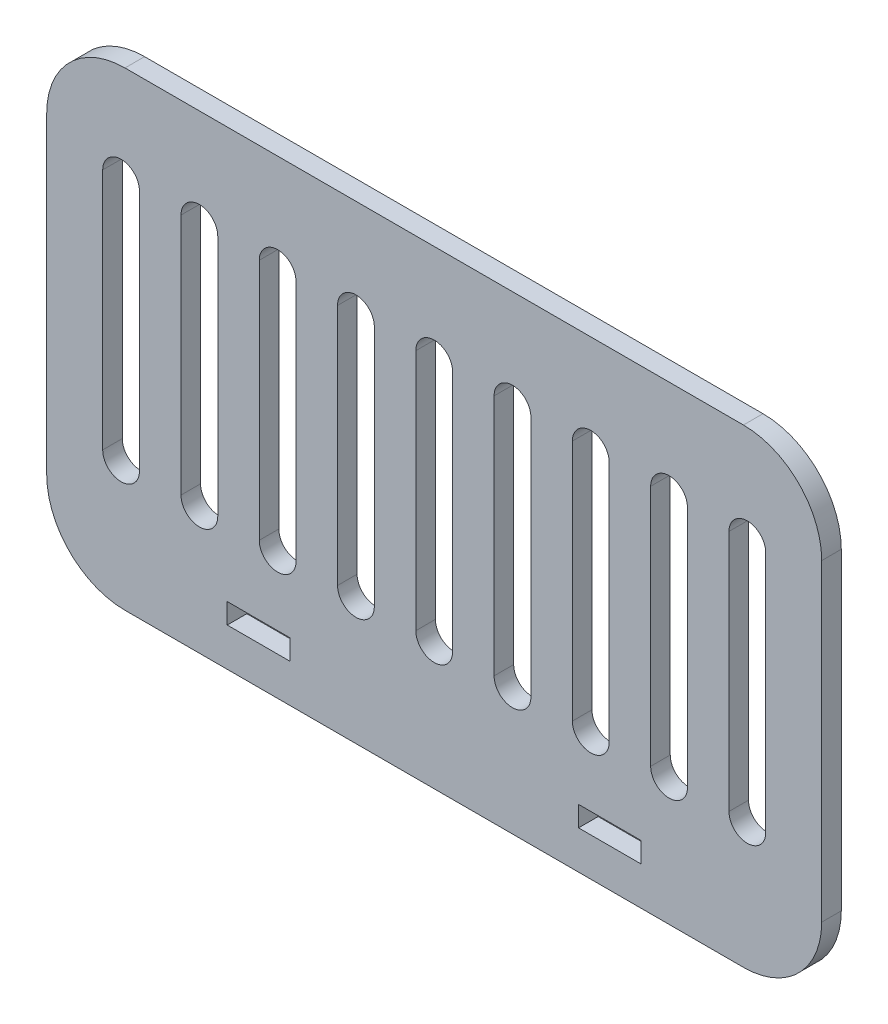
from build123d import *

# Parameters (mm, degrees)
SKETCH1_W           = 125.73
SKETCH1_H           = 76.2
SKETCH1_W_2         = 10.16
SKETCH1_H_2         = 3.302
BOSS_EXTRUDE1_DEPTH = 3.175
FILLET1_R           = 12.7
CUT_EXTRUDE2_DEPTH  = 74.577842113


with BuildPart() as part:
    # Sketch1 → Boss-Extrude1 (new body)
    with BuildSketch(Plane.XY):
        Rectangle(SKETCH1_W, SKETCH1_H)
        with Locations((-28.4988, -30.226)):
            Rectangle(SKETCH1_W_2, SKETCH1_H_2, mode=Mode.SUBTRACT)
        with Locations((28.4988, -30.226)):
            Rectangle(SKETCH1_W_2, SKETCH1_H_2, mode=Mode.SUBTRACT)
    extrude(amount=BOSS_EXTRUDE1_DEPTH)

    # Fillet1
    fillet1_edges = [part.edges().sort_by_distance(p)[0] for p in [
        (62.865, -38.1, 1.5875),
        (-62.865, -38.1, 1.5875),
        (-62.865, 38.1, 1.5875),
        (62.865, 38.1, 1.5875),
    ]]
    fillet(fillet1_edges, radius=FILLET1_R)

    # Sketch5 → Cut-Extrude2 (cut, through all)
    with BuildSketch(Plane.XY.offset(3.175)):
        with BuildLine():
            Line((2.984111333, 21.969779064), (2.984111333, -17.372056987))
            ThreePointArc((2.984111333, -17.372056987), (0, -20.35616832), (-2.984111333, -17.372056987))
            Line((-2.984111333, -17.372056987), (-2.984111333, 21.969779064))
            ThreePointArc((-2.984111333, 21.969779064), (0, 24.953890397), (2.984111333, 21.969779064))
        make_face()
        with BuildLine():
            Line((15.684111333, 21.969779064), (15.684111333, -17.372056987))
            ThreePointArc((15.684111333, -17.372056987), (12.7, -20.35616832), (9.715888667, -17.372056987))
            Line((9.715888667, -17.372056987), (9.715888667, 21.969779064))
            ThreePointArc((9.715888667, 21.969779064), (12.7, 24.953890397), (15.684111333, 21.969779064))
        make_face()
        with BuildLine():
            Line((28.384111333, 21.969779064), (28.384111333, -17.372056987))
            ThreePointArc((28.384111333, -17.372056987), (25.4, -20.35616832), (22.415888667, -17.372056987))
            Line((22.415888667, -17.372056987), (22.415888667, 21.969779064))
            ThreePointArc((22.415888667, 21.969779064), (25.4, 24.953890397), (28.384111333, 21.969779064))
        make_face()
        with BuildLine():
            Line((41.084111333, 21.969779064), (41.084111333, -17.372056987))
            ThreePointArc((41.084111333, -17.372056987), (38.1, -20.35616832), (35.115888667, -17.372056987))
            Line((35.115888667, -17.372056987), (35.115888667, 21.969779064))
            ThreePointArc((35.115888667, 21.969779064), (38.1, 24.953890397), (41.084111333, 21.969779064))
        make_face()
        with BuildLine():
            Line((53.784111333, 21.969779064), (53.784111333, -17.372056987))
            ThreePointArc((53.784111333, -17.372056987), (50.8, -20.35616832), (47.815888667, -17.372056987))
            Line((47.815888667, -17.372056987), (47.815888667, 21.969779064))
            ThreePointArc((47.815888667, 21.969779064), (50.8, 24.953890397), (53.784111333, 21.969779064))
        make_face()
        with BuildLine():
            Line((-9.715888667, 21.969779064), (-9.715888667, -17.372056987))
            ThreePointArc((-9.715888667, -17.372056987), (-12.7, -20.35616832), (-15.684111333, -17.372056987))
            Line((-15.684111333, -17.372056987), (-15.684111333, 21.969779064))
            ThreePointArc((-15.684111333, 21.969779064), (-12.7, 24.953890397), (-9.715888667, 21.969779064))
        make_face()
        with BuildLine():
            Line((-22.415888667, 21.969779064), (-22.415888667, -17.372056987))
            ThreePointArc((-22.415888667, -17.372056987), (-25.4, -20.35616832), (-28.384111333, -17.372056987))
            Line((-28.384111333, -17.372056987), (-28.384111333, 21.969779064))
            ThreePointArc((-28.384111333, 21.969779064), (-25.4, 24.953890397), (-22.415888667, 21.969779064))
        make_face()
        with BuildLine():
            Line((-35.115888667, 21.969779064), (-35.115888667, -17.372056987))
            ThreePointArc((-35.115888667, -17.372056987), (-38.1, -20.35616832), (-41.084111333, -17.372056987))
            Line((-41.084111333, -17.372056987), (-41.084111333, 21.969779064))
            ThreePointArc((-41.084111333, 21.969779064), (-38.1, 24.953890397), (-35.115888667, 21.969779064))
        make_face()
        with BuildLine():
            Line((-47.815888667, 21.969779064), (-47.815888667, -17.372056987))
            ThreePointArc((-47.815888667, -17.372056987), (-50.8, -20.35616832), (-53.784111333, -17.372056987))
            Line((-53.784111333, -17.372056987), (-53.784111333, 21.969779064))
            ThreePointArc((-53.784111333, 21.969779064), (-50.8, 24.953890397), (-47.815888667, 21.969779064))
        make_face()
    extrude(amount=-CUT_EXTRUDE2_DEPTH, mode=Mode.SUBTRACT)


solid = part.part
